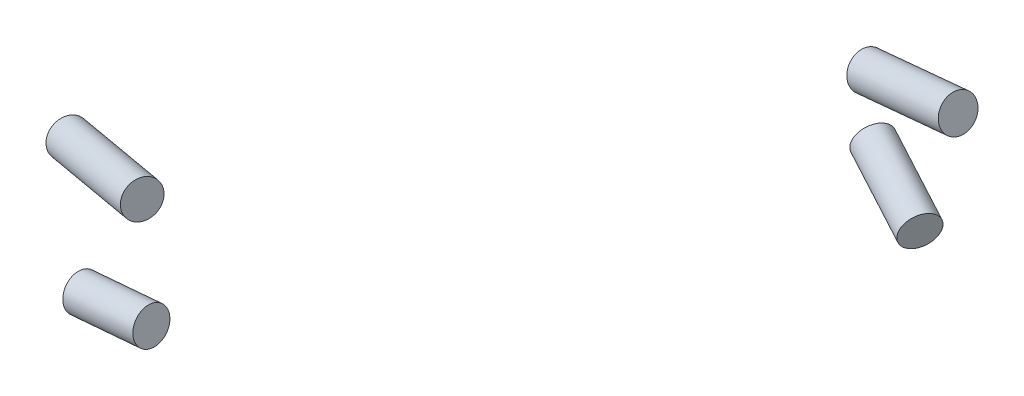
from build123d import *

# Parameters (mm, degrees)
SUSP_FL_ROCKER_BRACKET_A_PROFILE_R   = 7
SUSP_FL_ROCKER_BRACKET_B_PROFILE_R   = 7
SUSP_FL_COILOVER_BRACKET_A_PROFILE_R = 7
SUSP_FL_COILOVER_BRACKET_B_PROFILE_R = 7


with BuildPart() as part:
    # SUSP_FL_rocker_bracket_a: sweep along a curve in space
    with BuildLine() as susp_fl_rocker_bracket_a_path:
        Line((-253.16093, 3.06062272, -245.112504), (-282.547385, -0.733505554, -246.568112))
    # SUSP_FL_rocker_bracket_a profile (on start of the path) → SUSP_FL_rocker_bracket_a (sweep)
    with BuildSketch(Plane(origin=(-253.16093, 3.06062272, -245.112504), x_dir=(0.12804860626096684, -0.9917678934280055, 0), z_dir=(-0.990573329465155, -0.12789437435696369, -0.04906636281770392))):
        Circle(SUSP_FL_ROCKER_BRACKET_A_PROFILE_R)
    sweep(path=susp_fl_rocker_bracket_a_path.line)


with BuildPart() as body_2:
    # SUSP_FL_rocker_bracket_b: sweep along a curve in space
    with BuildLine() as susp_fl_rocker_bracket_b_path:
        Line((-258.30426, 43.4708888, -246.608444), (-300.152615, 37.6935056, -258.791888))
    # SUSP_FL_rocker_bracket_b profile (on start of the path) → SUSP_FL_rocker_bracket_b (sweep)
    with BuildSketch(Plane(origin=(-258.30426, 43.4708888, -246.608444), x_dir=(0.2795278895031742, 0, -0.9601375729497837), z_dir=(-0.951812297367076, -0.13140264118773481, -0.27710412568147824))):
        Circle(SUSP_FL_ROCKER_BRACKET_B_PROFILE_R)
    sweep(path=susp_fl_rocker_bracket_b_path.line)


with BuildPart() as body_3:
    # SUSP_FL_coilover_bracket_a: sweep along a curve in space
    with BuildLine() as susp_fl_coilover_bracket_a_path:
        Line((-166.026177, -30.2321009, -464.318765), (-198.557411, -22.1626116, -478.079469))
    # SUSP_FL_coilover_bracket_a profile (on start of the path) → SUSP_FL_coilover_bracket_a (sweep)
    with BuildSketch(Plane(origin=(-166.026177, -30.2321009, -464.318765), x_dir=(0.3895797084653776, 0, -0.9209927528227524), z_dir=(-0.8978602133296604, 0.22271744700368298, -0.37979464993569667))):
        Circle(SUSP_FL_COILOVER_BRACKET_A_PROFILE_R)
    sweep(path=susp_fl_coilover_bracket_a_path.line)


with BuildPart() as body_4:
    # SUSP_FL_coilover_bracket_b: sweep along a curve in space
    with BuildLine() as susp_fl_coilover_bracket_b_path:
        Line((-164.805861, 4.04738961, -478.324842), (-206.559789, -4.69578838, -483.635731))
    # SUSP_FL_coilover_bracket_b profile (on start of the path) → SUSP_FL_coilover_bracket_b (sweep)
    with BuildSketch(Plane(origin=(-164.805861, 4.04738961, -478.324842), x_dir=(0.2049526189830252, -0.9787718957816468, 0), z_dir=(-0.9712739650393727, -0.20338256926132248, -0.1235411484379151))):
        Circle(SUSP_FL_COILOVER_BRACKET_B_PROFILE_R)
    sweep(path=susp_fl_coilover_bracket_b_path.line)


solid = Compound([part.part, body_2.part, body_3.part, body_4.part])
